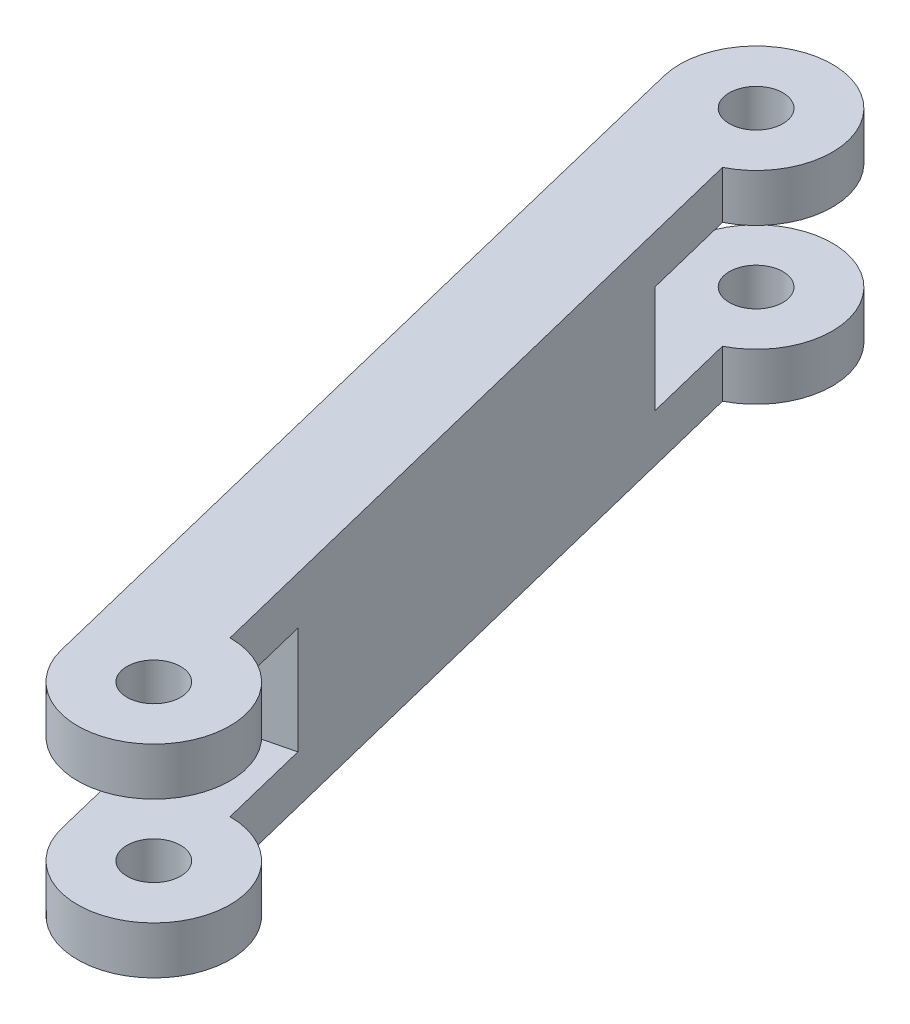
from build123d import *

# Parameters (mm, degrees)
SKETCH1_R           = 1.125
BOSS_EXTRUDE7_DEPTH = 8.5
SKETCH6_W           = 15.97698267
SKETCH6_H           = 4.5
SKETCH6_W_2         = 15.99015053
CUT_EXTRUDE3_DEPTH  = 8.5


with BuildPart() as part:
    # Sketch1 → Boss-Extrude7 (new body)
    with BuildSketch(Plane(origin=(0, 0, 0), x_dir=(1, 0, 0), z_dir=(0, 1, 0))):
        with BuildLine():
            Line((-11.69237608, 36.011313204), (-3.480621039, 2.520436225))
            ThreePointArc((-3.480621039, 2.520436225), (2.14510964, 1.307458387), (-0.372682187, 6.48248353))
            Line((-0.372682187, 6.48248353), (-7.140204337, 33.917806035))
            ThreePointArc((-7.140204337, 33.917806035), (-7.247398542, 39.680649203), (-11.69237608, 36.011313204))
        make_face()
        with Locations(Location((-8.584437228, 36.773360509, 0), (0, 0, 270))):
            Circle(SKETCH1_R, mode=Mode.SUBTRACT)
        with Locations(Location((-0.372682187, 3.28248353, 0), (0, 0, 270))):
            Circle(SKETCH1_R, mode=Mode.SUBTRACT)
    extrude(amount=BOSS_EXTRUDE7_DEPTH)

    # Sketch6 → Cut-Extrude3 (cut)
    with BuildSketch(Plane(origin=(-2.700284633, 0, 0.662093022), x_dir=(0.2381397827013172, 0, 0.9712308911350428), z_dir=(-0.9712308911350428, 0, 0.2381397827013172))):
        with Locations((-38.748211048, 4.25)):
            Rectangle(SKETCH6_W, SKETCH6_H)
        with Locations((-2.281724594, 4.25)):
            Rectangle(SKETCH6_W_2, SKETCH6_H)
    extrude(amount=-CUT_EXTRUDE3_DEPTH, mode=Mode.SUBTRACT)


solid = part.part
